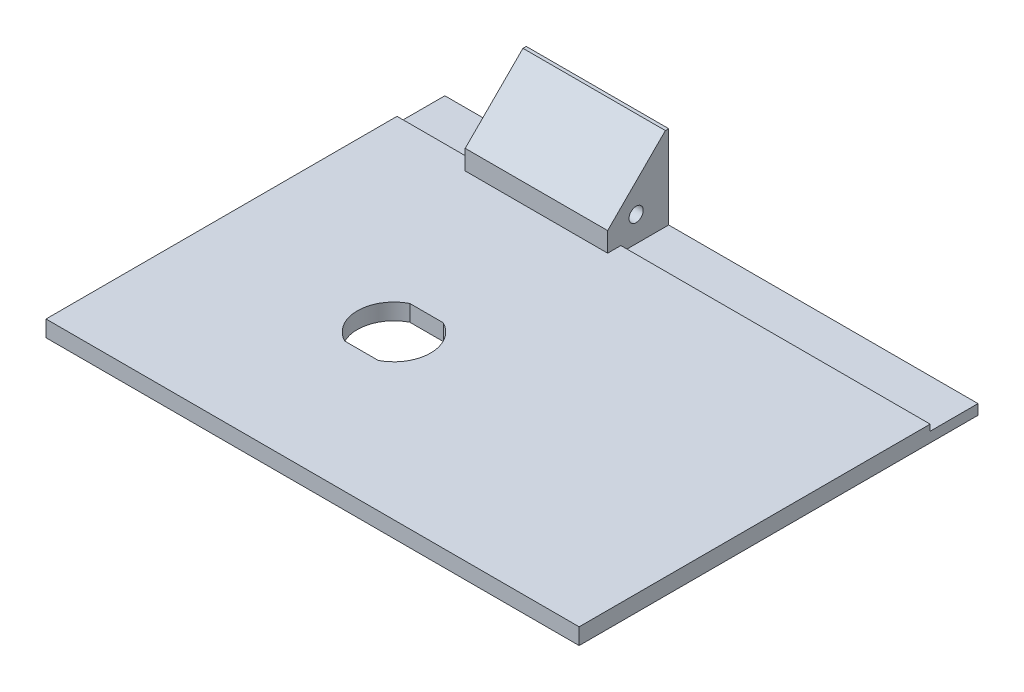
from build123d import *

# Parameters (mm, degrees)
SKETCH1_W               = 131
SKETCH1_H               = 98
BOSS_EXTRUDE1_DEPTH     = 4
LOCK_HOLE_DEPTH         = 82.897802168
SKETCH6_W               = 11.75
SKETCH6_H               = 1.5
CUT_EXTRUDE4_DEPTH      = 131
SKETCH3_W               = 35
SKETCH3_H               = 15
BOSS_EXTRUDE2_DEPTH     = 19
SKETCH4_R               = 1.75
CUT_EXTRUDE2_DEPTH      = 35
CUT_EXTRUDE3_DEPTH      = 124.494939168
CUT_EXTRUDE3_DEPTH_BACK = 124.494939168
SKETCH7_W               = 35
SKETCH7_H               = 1.5
BOSS_EXTRUDE3_DEPTH     = 11.75


with BuildPart() as part:
    # Sketch1 → Boss-Extrude1 (new body)
    with BuildSketch(Plane(origin=(0, 0, 0), x_dir=(1, 0, 0), z_dir=(0, 1, 0))):
        Rectangle(SKETCH1_W, SKETCH1_H)
    extrude(amount=BOSS_EXTRUDE1_DEPTH)

    # Lock → Lock Hole (cut, through all)
    with BuildSketch(Plane(origin=(0, 4, 0), x_dir=(1, 0, 0), z_dir=(0, 1, 0))):
        with BuildLine():
            Line((-24.123105626, -1), (-15.876894374, -1))
            ThreePointArc((-15.876894374, -1), (-11, -9), (-15.876894374, -17))
            Line((-15.876894374, -17), (-24.123105626, -17))
            ThreePointArc((-24.123105626, -17), (-29, -9), (-24.123105626, -1))
        make_face()
    extrude(amount=-LOCK_HOLE_DEPTH, mode=Mode.SUBTRACT)

    # Sketch6 → Cut-Extrude4 (cut)
    with BuildSketch(Plane.ZY.offset(65.5)):
        with Locations((-43.125, 3.25)):
            Rectangle(SKETCH6_W, SKETCH6_H)
    extrude(amount=-CUT_EXTRUDE4_DEPTH, mode=Mode.SUBTRACT)

    # Sketch3 → Boss-Extrude2 (add)
    with BuildSketch(Plane(origin=(0, 4, 0), x_dir=(1, 0, 0), z_dir=(0, 1, 0))):
        with Locations((-28, 41.5)):
            Rectangle(SKETCH3_W, SKETCH3_H)
    extrude(amount=BOSS_EXTRUDE2_DEPTH)

    # Sketch4 → Cut-Extrude2 (cut)
    with BuildSketch(Plane.ZY.offset(45.5)):
        with Locations((-41, 8.75)):
            Circle(SKETCH4_R)
    extrude(amount=-CUT_EXTRUDE2_DEPTH, mode=Mode.SUBTRACT)

    # Sketch5 → Cut-Extrude3 (cut, two sides: drawn at the far end of the back side and taken through both)
    with BuildSketch(Plane.ZY.offset(45.5).offset(-CUT_EXTRUDE3_DEPTH_BACK)):
        Polygon((-34, 8.811703297), (-48.188296703, 23), (-34, 23), align=None)
    extrude(amount=CUT_EXTRUDE3_DEPTH + CUT_EXTRUDE3_DEPTH_BACK, mode=Mode.SUBTRACT)

    # Sketch7 → Boss-Extrude3 (add)
    with BuildSketch(Plane(origin=(0, 0, -49), x_dir=(-1, 0, 0), z_dir=(0, 0, -1))):
        with Locations((28, 3.25)):
            Rectangle(SKETCH7_W, SKETCH7_H)
    extrude(amount=-BOSS_EXTRUDE3_DEPTH)


solid = part.part
